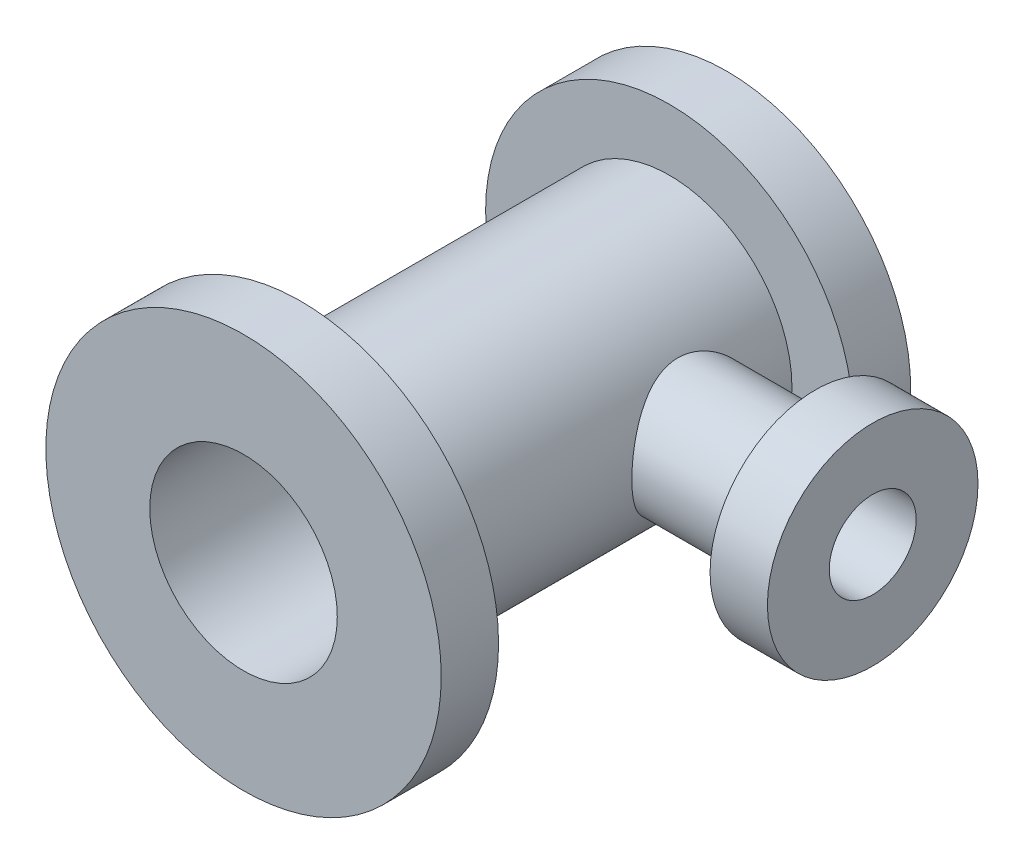
from build123d import *

# Parameters (mm, degrees)
SKETCH1_R          = 29.897826087
SKETCH1_R_2        = 22.892183977
EXTRUDE1_DEPTH     = 113
SKETCH2_R          = 15.706317554
SKETCH2_R_2        = 10.616968436
EXTRUDE2_DEPTH     = 59
CUT_EXTRUDE1_START = -222
SKETCH3_R          = 22.892183977
CUT_EXTRUDE1_DEPTH = 222
CUT_EXTRUDE2_START = -48
SKETCH4_R          = 10.616968436
CUT_EXTRUDE2_DEPTH = 48
EXTRUDE3_START     = -14
SKETCH5_R          = 48.264644084
SKETCH5_R_2        = 29.897826087
EXTRUDE3_DEPTH     = 14
SKETCH6_R          = 44.897826087
SKETCH6_R_2        = 29.897826087
EXTRUDE4_DEPTH     = 9
EXTRUDE5_START     = 5
SKETCH7_R          = 44.897826087
SKETCH7_R_2        = 22.892183977
EXTRUDE5_DEPTH     = 5
SKETCH8_R          = 25.706317554
SKETCH8_R_2        = 10.616968436
EXTRUDE6_DEPTH     = 14


with BuildPart() as part:
    # Sketch1 → Extrude1 (new body)
    with BuildSketch(Plane.XY):
        Circle(SKETCH1_R)
        Circle(SKETCH1_R_2, mode=Mode.SUBTRACT)
    extrude(amount=EXTRUDE1_DEPTH)

    # Sketch2 → Extrude2 (add)
    with BuildSketch(Plane(origin=(0, 0, 0), x_dir=(0, 0, -1), z_dir=(1, 0, 0))):
        with Locations((-32.385873212, 0)):
            Circle(SKETCH2_R)
        with Locations(Location((-32.385873212, 0, 0), (0, 0, 180))):
            Circle(SKETCH2_R_2, mode=Mode.SUBTRACT)
    extrude(amount=EXTRUDE2_DEPTH)

    # Sketch3 → Cut-Extrude1 (cut)
    with BuildSketch(Plane.XY.offset(113).offset(CUT_EXTRUDE1_START)):
        Circle(SKETCH3_R)
    extrude(amount=CUT_EXTRUDE1_DEPTH, mode=Mode.SUBTRACT)

    # Sketch4 → Cut-Extrude2 (cut)
    with BuildSketch(Plane(origin=(59, 0, 0), x_dir=(0, 0, -1), z_dir=(1, 0, 0)).offset(CUT_EXTRUDE2_START)):
        with Locations((-32.385873212, 0)):
            Circle(SKETCH4_R)
    extrude(amount=CUT_EXTRUDE2_DEPTH, mode=Mode.SUBTRACT)

    # Sketch5 → Extrude3 (add)
    with BuildSketch(Plane.XY.offset(113).offset(EXTRUDE3_START)):
        Circle(SKETCH5_R)
        Circle(SKETCH5_R_2, mode=Mode.SUBTRACT)
    extrude(amount=EXTRUDE3_DEPTH)

    # Sketch6 → Extrude4 (add)
    with BuildSketch(Plane(origin=(0, 0, 0), x_dir=(-1, 0, 0), z_dir=(0, 0, -1))):
        Circle(SKETCH6_R)
        Circle(SKETCH6_R_2, mode=Mode.SUBTRACT)
    extrude(amount=-EXTRUDE4_DEPTH)

    # Sketch7 → Extrude5 (add)
    with BuildSketch(Plane(origin=(0, 0, 0), x_dir=(-1, 0, 0), z_dir=(0, 0, -1)).offset(EXTRUDE5_START)):
        Circle(SKETCH7_R)
        Circle(SKETCH7_R_2, mode=Mode.SUBTRACT)
    extrude(amount=-EXTRUDE5_DEPTH)

    # Sketch8 → Extrude6 (add)
    with BuildSketch(Plane(origin=(59, 0, 0), x_dir=(0, 0, -1), z_dir=(1, 0, 0))):
        with Locations((-32.385873212, 0)):
            Circle(SKETCH8_R)
        with Locations((-32.385873212, 0)):
            Circle(SKETCH8_R_2, mode=Mode.SUBTRACT)
    extrude(amount=EXTRUDE6_DEPTH)


solid = part.part
